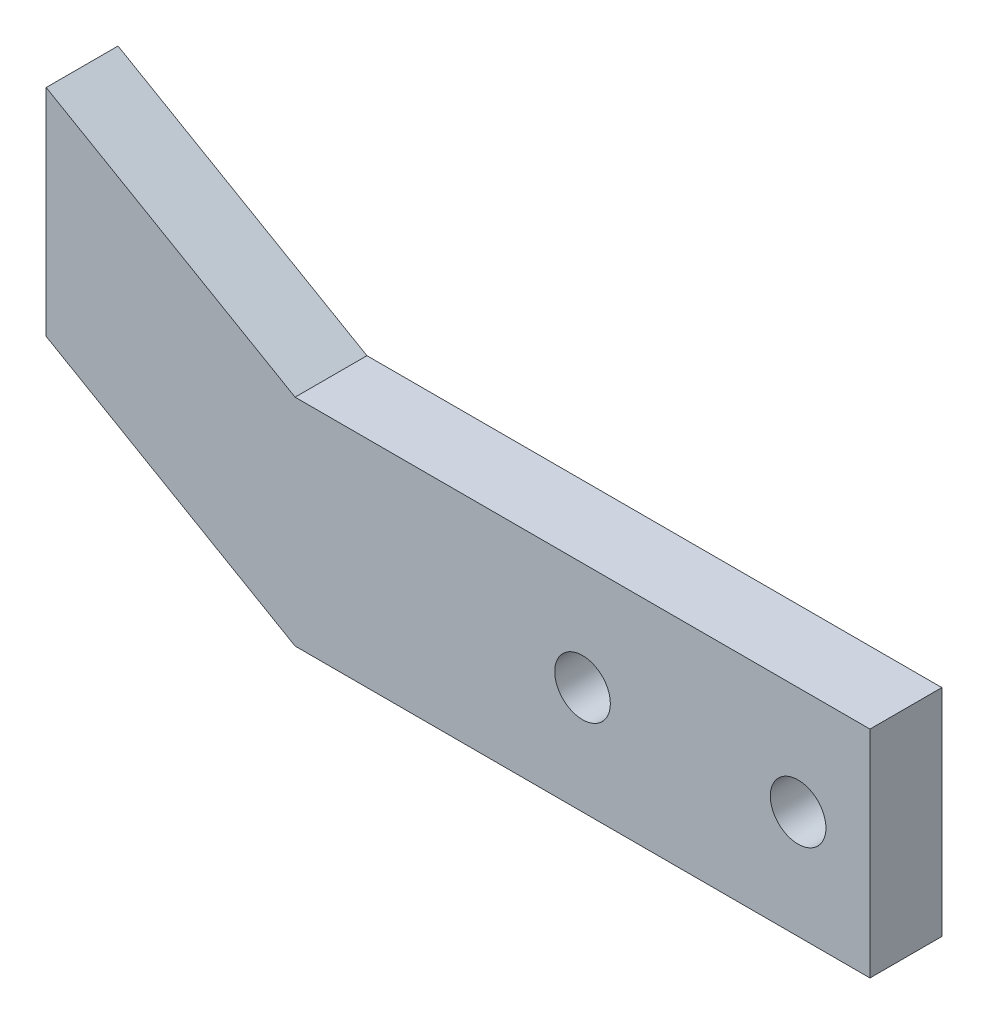
from build123d import *

# Parameters (mm, degrees)
BOSS_EXTRUDE1_DEPTH          = 6.35
F_10_0_1935_DIAMETER_HOLE1_D = 4.9149


with BuildPart() as part:
    # Sketch1 → Boss-Extrude1 (new body)
    with BuildSketch(Plane.XY):
        Polygon((0, 0), (-21.997045256, 12.7), (-21.997045256, 31.75), (0, 19.05), (50.8, 19.05), (50.8, 0), align=None)
    extrude(amount=BOSS_EXTRUDE1_DEPTH)

    # #10 (0.1935) Diameter Hole1 (through all)
    with Locations(Plane.XY.offset(6.35)):
        with Locations((44.45, 9.525), (25.4, 9.525)):
            Hole(F_10_0_1935_DIAMETER_HOLE1_D / 2)


solid = part.part
